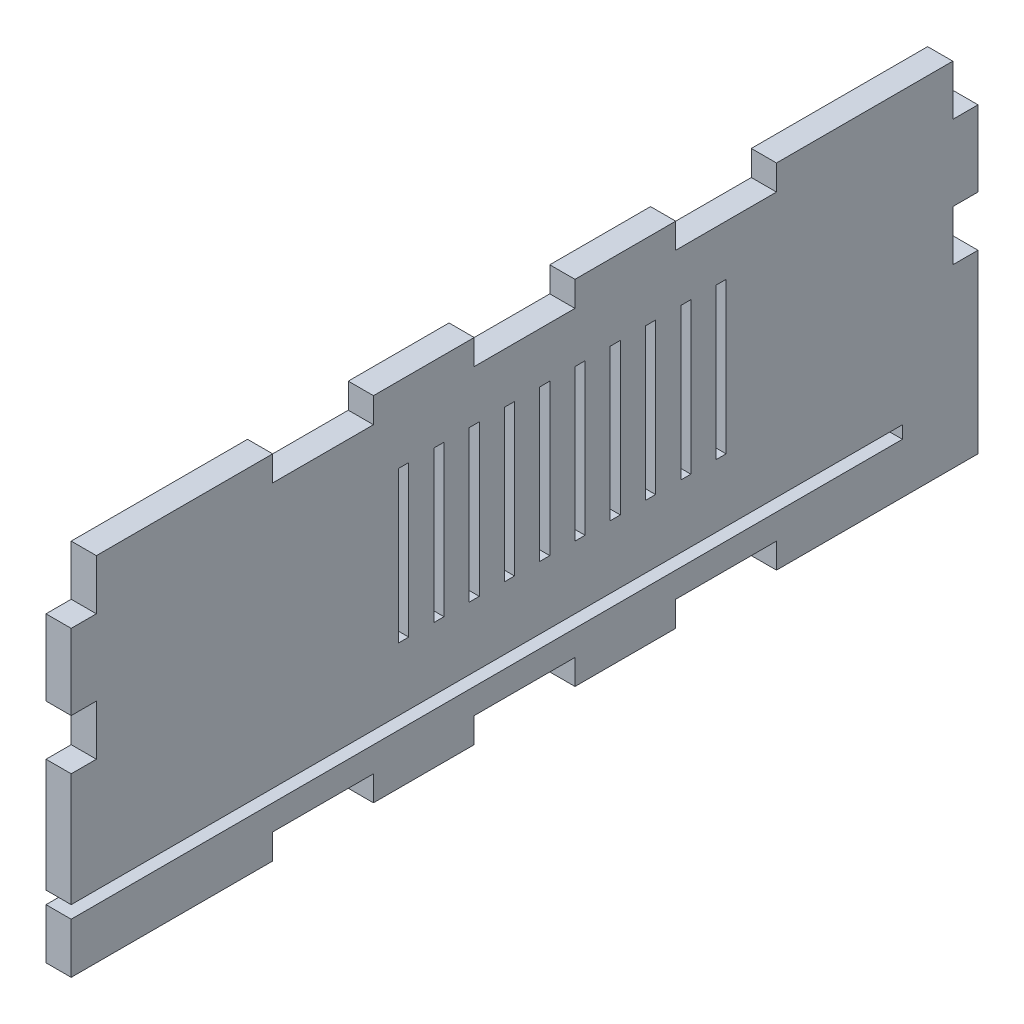
from build123d import *

# Parameters (mm, degrees)
ESQUISSE1_W             = 180
ESQUISSE1_H             = 70
BOSS_EXTRU_1_DEPTH      = 5
ESQUISSE2_W             = 165
ESQUISSE2_H             = 2.5
ENL_V_MAT_EXTRU_1_DEPTH = 5
ESQUISSE3_W             = 5
ESQUISSE3_H             = 10
ESQUISSE3_W_2           = 20
ESQUISSE3_H_2           = 5
ENL_V_MAT_EXTRU_2_DEPTH = 5
ESQUISSE4_W             = 2
ESQUISSE4_H             = 30
ENL_V_MAT_EXTRU_3_DEPTH = 5


with BuildPart() as part:
    # Esquisse1 → Boss.-Extru.1 (new body)
    with BuildSketch(Plane(origin=(0, 0, 0), x_dir=(0, 0, -1), z_dir=(1, 0, 0))):
        Rectangle(ESQUISSE1_W, ESQUISSE1_H)
    extrude(amount=BOSS_EXTRU_1_DEPTH)

    # Esquisse2 → Enlèv. mat.-Extru.1 (cut)
    with BuildSketch(Plane(origin=(5, 0, 0), x_dir=(0, 0, -1), z_dir=(1, 0, 0))):
        with Locations((-7.5, -23.75)):
            Rectangle(ESQUISSE2_W, ESQUISSE2_H)
    extrude(amount=-ENL_V_MAT_EXTRU_1_DEPTH, mode=Mode.SUBTRACT)

    # Esquisse3 → Enlèv. mat.-Extru.2 (cut)
    with BuildSketch(Plane(origin=(5, 0, 0), x_dir=(0, 0, -1), z_dir=(1, 0, 0))):
        with Locations((-87.5, 30)):
            Rectangle(ESQUISSE3_W, ESQUISSE3_H)
        with Locations((-87.5, 5)):
            Rectangle(ESQUISSE3_W, ESQUISSE3_H)
        with Locations((87.5, 30)):
            Rectangle(ESQUISSE3_W, ESQUISSE3_H)
        with Locations((87.5, 5)):
            Rectangle(ESQUISSE3_W, ESQUISSE3_H)
        with Locations((-40, 32.5)):
            Rectangle(ESQUISSE3_W_2, ESQUISSE3_H_2)
        with Locations((40, 32.5)):
            Rectangle(ESQUISSE3_W_2, ESQUISSE3_H_2)
        with Locations((0, 32.5)):
            Rectangle(ESQUISSE3_W_2, ESQUISSE3_H_2)
        with Locations((-40, -32.5)):
            Rectangle(ESQUISSE3_W_2, ESQUISSE3_H_2)
        with Locations((0, -32.5)):
            Rectangle(ESQUISSE3_W_2, ESQUISSE3_H_2)
        with Locations((40, -32.5)):
            Rectangle(ESQUISSE3_W_2, ESQUISSE3_H_2)
    extrude(amount=-ENL_V_MAT_EXTRU_2_DEPTH, mode=Mode.SUBTRACT)

    # Esquisse4 → Enlèv. mat.-Extru.3 (cut)
    with BuildSketch(Plane(origin=(5, 0, 0), x_dir=(0, 0, -1), z_dir=(1, 0, 0))):
        with Locations((32, 5)):
            Rectangle(ESQUISSE4_W, ESQUISSE4_H)
        with Locations((39, 5)):
            Rectangle(ESQUISSE4_W, ESQUISSE4_H)
        with Locations((25, 5)):
            Rectangle(ESQUISSE4_W, ESQUISSE4_H)
        with Locations((18, 5)):
            Rectangle(ESQUISSE4_W, ESQUISSE4_H)
        with Locations((11, 5)):
            Rectangle(ESQUISSE4_W, ESQUISSE4_H)
        with Locations((4, 5)):
            Rectangle(ESQUISSE4_W, ESQUISSE4_H)
        with Locations((-3, 5)):
            Rectangle(ESQUISSE4_W, ESQUISSE4_H)
        with Locations((-10, 5)):
            Rectangle(ESQUISSE4_W, ESQUISSE4_H)
        with Locations((-17, 5)):
            Rectangle(ESQUISSE4_W, ESQUISSE4_H)
        with Locations((-24, 5)):
            Rectangle(ESQUISSE4_W, ESQUISSE4_H)
    extrude(amount=-ENL_V_MAT_EXTRU_3_DEPTH, mode=Mode.SUBTRACT)


solid = part.part
